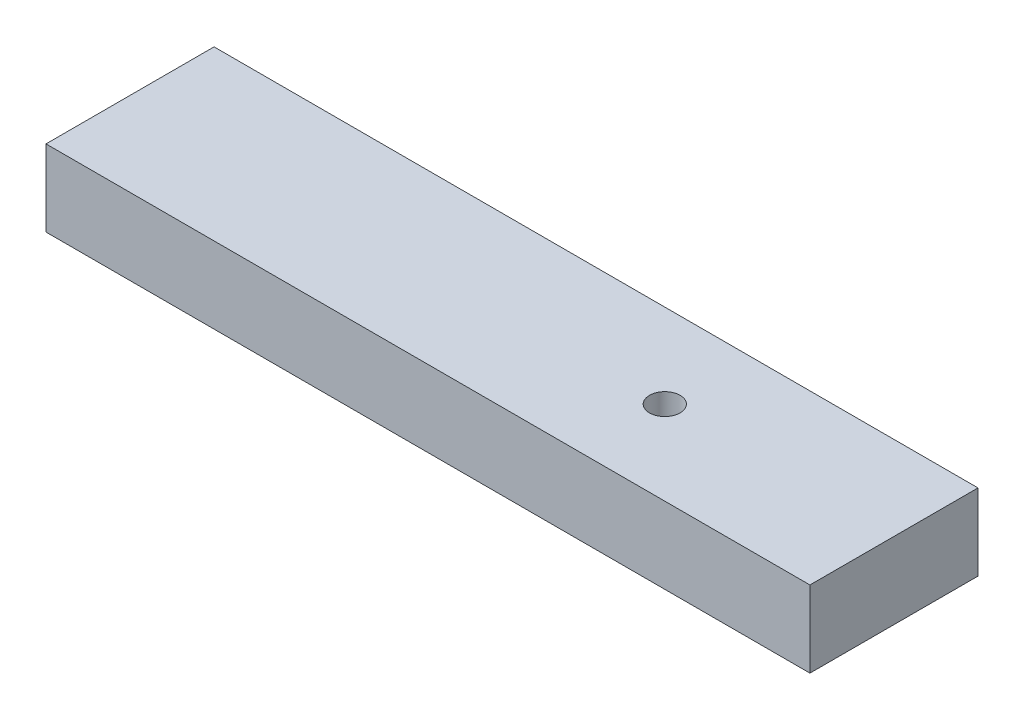
from build123d import *

# Parameters (mm, degrees)
SKETCH1_W           = 250
SKETCH1_H           = 55
BOSS_EXTRUDE1_DEPTH = 25
SKETCH2_R           = 5
CUT_EXTRUDE1_DEPTH  = 131.408013557


with BuildPart() as part:
    # Sketch1 → Boss-Extrude1 (new body)
    with BuildSketch(Plane(origin=(0, 0, 0), x_dir=(1, 0, 0), z_dir=(0, 1, 0))):
        Rectangle(SKETCH1_W, SKETCH1_H)
    extrude(amount=BOSS_EXTRUDE1_DEPTH)

    # Sketch2 → Cut-Extrude1 (cut, through all)
    with BuildSketch(Plane(origin=(0, 25, 0), x_dir=(1, 0, 0), z_dir=(0, 1, 0))):
        with Locations(Location((50, 0, 0), (0, 0, 270))):
            Circle(SKETCH2_R)
    extrude(amount=-CUT_EXTRUDE1_DEPTH, mode=Mode.SUBTRACT)


solid = part.part
